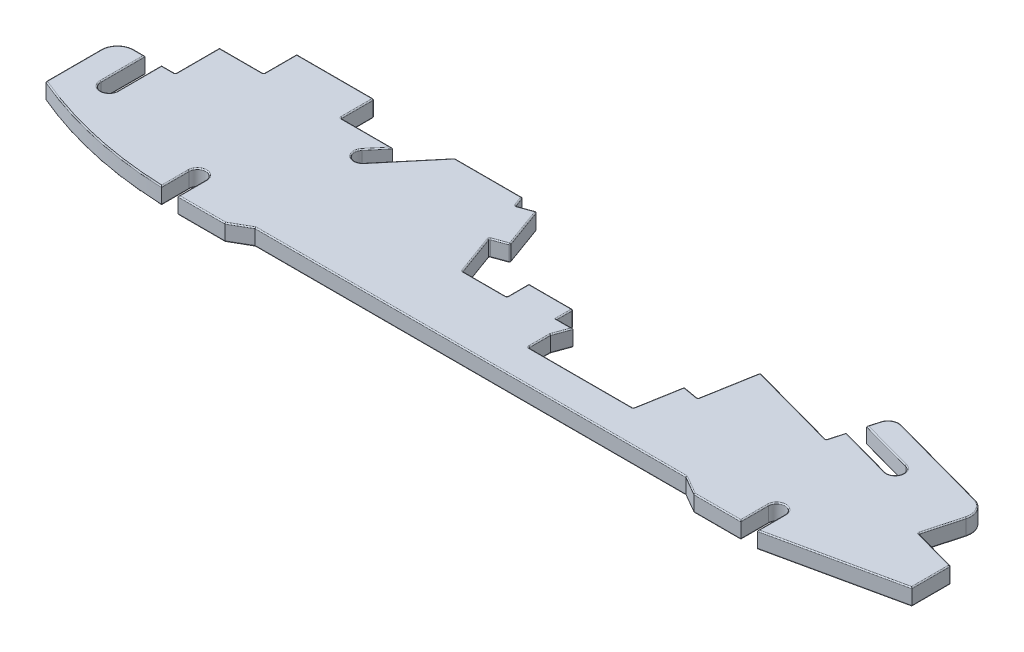
from build123d import *

# Parameters (mm, degrees)
BOSS_EXTRUDE1_DEPTH = 3
FILLET1_R           = 0.2


with BuildPart() as part:
    # Sketch1 → Boss-Extrude1 (new body)
    with BuildSketch(Plane(origin=(0, 0, 0), x_dir=(1, 0, 0), z_dir=(0, 1, 0))):
        with BuildLine():
            Line((-1.5, 0), (-1.5, -5))
            Line((-1.5, -5), (-10, -5))
            Line((-10, -5), (-13.464101615, -3))
            Line((-13.464101615, -3), (-91.535898385, -3))
            Line((-91.535898385, -3), (-95, -5))
            Line((-95, -5), (-103.5, -5))
            Line((-103.5, -5), (-103.5, 0))
            ThreePointArc((-103.5, 0), (-105, 1.5), (-106.5, 0))
            Line((-106.5, 0), (-106.5, -5))
            ThreePointArc((-106.5, -5), (-120.278978154, -3.255401694), (-133.5, 1))
            Line((-133.5, 1), (-133.5, 11))
            ThreePointArc((-133.5, 11), (-132.621320344, 13.121320344), (-130.5, 14))
            Line((-130.5, 14), (-128.5, 14))
            Line((-128.5, 14), (-128.5, 6))
            ThreePointArc((-128.5, 6), (-127, 4.5), (-125.5, 6))
            Line((-125.5, 6), (-125.5, 14))
            Line((-125.5, 14), (-123, 14))
            Line((-123, 14), (-123, 22))
            Line((-123, 22), (-115, 22))
            Line((-115, 22), (-115, 28))
            Line((-115, 28), (-101, 28))
            Line((-101, 28), (-101, 22))
            Line((-101, 22), (-91.601712409, 22))
            Line((-91.601712409, 22), (-94.149066665, 18.964181415))
            ThreePointArc((-94.149066665, 18.964181415), (-93.964181415, 16.850933335), (-91.850933335, 17.035818585))
            Line((-91.850933335, 17.035818585), (-84.329092017, 26))
            Line((-84.329092017, 26), (-72.09558328, 26))
            Line((-72.09558328, 26), (-71.38041159, 24.035081933))
            Line((-71.38041159, 24.035081933), (-68.561333728, 25.061142363))
            Line((-68.561333728, 25.061142363), (-65.825172581, 17.543601396))
            Line((-65.825172581, 17.543601396), (-68.644250444, 16.517540966))
            Line((-68.644250444, 16.517540966), (-65.908089297, 9))
            Line((-65.908089297, 9), (-57.908089297, 9))
            Line((-57.908089297, 9), (-57.908089297, 13))
            Line((-57.908089297, 13), (-49.908089297, 13))
            Line((-49.908089297, 13), (-49.908089297, 10))
            Line((-49.908089297, 10), (-46.908089297, 10))
            Line((-46.908089297, 10), (-48, 7))
            Line((-48, 7), (-48, 3))
            Line((-48, 3), (-29, 3))
            Line((-29, 3), (-27.610814579, 10.878462024))
            Line((-27.610814579, 10.878462024), (-24.65639132, 10.357517491))
            Line((-24.65639132, 10.357517491), (-22.956161492, 20))
            Line((-22.956161492, 20), (-6.560221994, 15.508545007))
            Line((-6.560221994, 15.508545007), (-5.767612289, 18.401946095))
            Line((-5.767612289, 18.401946095), (3.877058004, 15.759913746))
            ThreePointArc((3.877058004, 15.759913746), (5.720063401, 16.810309438), (4.669667709, 18.653314834))
            Line((4.669667709, 18.653314834), (-4.975002584, 21.295347183))
            Line((-4.975002584, 21.295347183), (-4.446596115, 23.224281242))
            ThreePointArc((-4.446596115, 23.224281242), (-3.507984611, 24.433476923), (-1.989255586, 24.624808831))
            Line((-1.989255586, 24.624808831), (16.335617971, 19.604947368))
            ThreePointArc((16.335617971, 19.604947368), (18.149411494, 18.197030113), (18.436409355, 15.918936575))
            Line((18.436409355, 15.918936575), (16.586986711, 9.16766737))
            Line((16.586986711, 9.16766737), (24.5, 7))
            Line((24.5, 7), (24.5, 0))
            Line((24.5, 0), (1.5, -5))
            Line((1.5, -5), (1.5, 0))
            ThreePointArc((1.5, 0), (0, 1.5), (-1.5, 0))
        make_face()
    extrude(amount=BOSS_EXTRUDE1_DEPTH)

    # Fillet1
    fillet1_edges = [part.edges().sort_by_distance(p)[0] for p in [
        (13, 3, 2.5),
        (-88.090012676, 3, -21.517909293),
        (-93.964181415, 3, -16.850933335),
        (-92.875389537, 3, -20.482090707),
        (-96.300856205, 3, -22),
        (-101, 3, -25),
        (-108, 3, -28),
        (-115, 3, -25),
        (-119, 3, -22),
        (-123, 3, -18),
        (-124.25, 3, -14),
        (24.5, 3, -3.5),
        (-125.5, 3, -10),
        (-127, 3, -4.5),
        (-128.5, 3, -10),
        (-129.5, 3, -14),
        (-132.621320344, 3, -13.121320344),
        (-133.5, 3, -6),
        (-120.278978154, 3, 3.255401694),
        (-106.5, 3, 2.5),
        (-105, 3, -1.5),
        (-103.5, 3, 2.5),
        (20.543493355, 3, -8.083833685),
        (-99.25, 3, 5),
        (-93.267949192, 3, 4),
        (-52.5, 3, 3),
        (-11.732050808, 3, 4),
        (-5.75, 3, 5),
        (-1.5, 3, 2.5),
        (17.511698033, 3, -12.543301972),
        (18.149411494, 3, -18.197030113),
        (7.173181193, 3, -22.114878099),
        (-3.507984611, 3, -24.433476923),
        (-4.710799349, 3, -22.259814212),
        (-0.152667438, 3, -19.974331009),
        (5.720063401, 3, -16.810309438),
        (0, 3, -1.5),
        (-0.945277142, 3, -17.080929921),
        (-6.163917141, 3, -16.955245551),
        (-14.758191743, 3, -17.754272503),
        (-1.5, 0, 2.5),
        (-5.75, 0, 5),
        (-11.732050808, 0, 4),
        (-52.5, 0, 3),
        (-23.806276406, 3, -15.178758746),
        (-93.267949192, 0, 4),
        (-99.25, 0, 5),
        (-103.5, 0, 2.5),
        (-105, 0, -1.5),
        (-106.5, 0, 2.5),
        (-120.278978154, 0, 3.255401694),
        (-133.5, 0, -6),
        (-26.133602949, 3, -10.617989758),
        (-132.621320344, 0, -13.121320344),
        (-129.5, 0, -14),
        (-128.5, 0, -10),
        (-127, 0, -4.5),
        (-125.5, 0, -10),
        (-124.25, 0, -14),
        (-123, 0, -18),
        (-119, 0, -22),
        (-28.305407289, 3, -6.939231012),
        (-115, 0, -25),
        (-108, 0, -28),
        (-101, 0, -25),
        (-96.300856205, 0, -22),
        (-92.875389537, 0, -20.482090707),
        (-93.964181415, 0, -16.850933335),
        (-88.090012676, 0, -21.517909293),
        (-38.5, 3, -3),
        (-78.212337648, 0, -26),
        (-71.737997435, 0, -25.017540966),
        (-69.970872659, 0, -24.548112148),
        (-67.193253155, 0, -21.302371879),
        (-67.234711513, 0, -17.030571181),
        (-67.276169871, 0, -12.758770483),
        (-61.908089297, 0, -9),
        (-57.908089297, 0, -11),
        (-48, 3, -5),
        (-53.908089297, 0, -13),
        (-49.908089297, 0, -11.5),
        (-48.408089297, 0, -10),
        (-47.454044649, 0, -8.5),
        (-48, 0, -5),
        (-38.5, 0, -3),
        (-28.305407289, 0, -6.939231012),
        (-47.454044649, 3, -8.5),
        (-26.133602949, 0, -10.617989758),
        (-23.806276406, 0, -15.178758746),
        (-14.758191743, 0, -17.754272503),
        (-6.163917141, 0, -16.955245551),
        (-0.945277142, 0, -17.080929921),
        (5.720063401, 0, -16.810309438),
        (-0.152667438, 0, -19.974331009),
        (-4.710799349, 0, -22.259814212),
        (-48.408089297, 3, -10),
        (-3.507984611, 0, -24.433476923),
        (7.173181193, 0, -22.114878099),
        (18.149411494, 0, -18.197030113),
        (17.511698033, 0, -12.543301972),
        (20.543493355, 0, -8.083833685),
        (24.5, 0, -3.5),
        (13, 0, 2.5),
        (1.5, 3, 2.5),
        (-49.908089297, 3, -11.5),
        (1.5, 0, 2.5),
        (0, 0, -1.5),
        (-53.908089297, 3, -13),
        (-57.908089297, 3, -11),
        (-61.908089297, 3, -9),
        (-67.276169871, 3, -12.758770483),
        (-67.234711513, 3, -17.030571181),
        (-67.193253155, 3, -21.302371879),
        (-133.5, 1.5, -1),
        (-123, 1.5, -14),
        (-123, 1.5, -22),
        (-115, 1.5, -22),
        (-115, 1.5, -28),
        (-101, 1.5, -28),
        (-101, 1.5, -22),
        (-69.970872659, 3, -24.548112148),
        (-72.09558328, 1.5, -26),
        (-71.38041159, 1.5, -24.035081933),
        (-68.561333728, 1.5, -25.061142363),
        (-65.825172581, 1.5, -17.543601396),
        (-68.644250444, 1.5, -16.517540966),
        (-65.908089297, 1.5, -9),
        (-57.908089297, 1.5, -9),
        (-57.908089297, 1.5, -13),
        (-49.908089297, 1.5, -13),
        (-48, 1.5, -3),
        (-29, 1.5, -3),
        (-27.610814579, 1.5, -10.878462024),
        (-24.65639132, 1.5, -10.357517491),
        (-22.956161492, 1.5, -20),
        (-6.560221994, 1.5, -15.508545007),
        (16.586986711, 1.5, -9.16766737),
        (24.5, 1.5, -7),
        (-71.737997435, 3, -25.017540966),
        (-78.212337648, 3, -26),
    ]]
    fillet(fillet1_edges, radius=FILLET1_R)


solid = part.part
